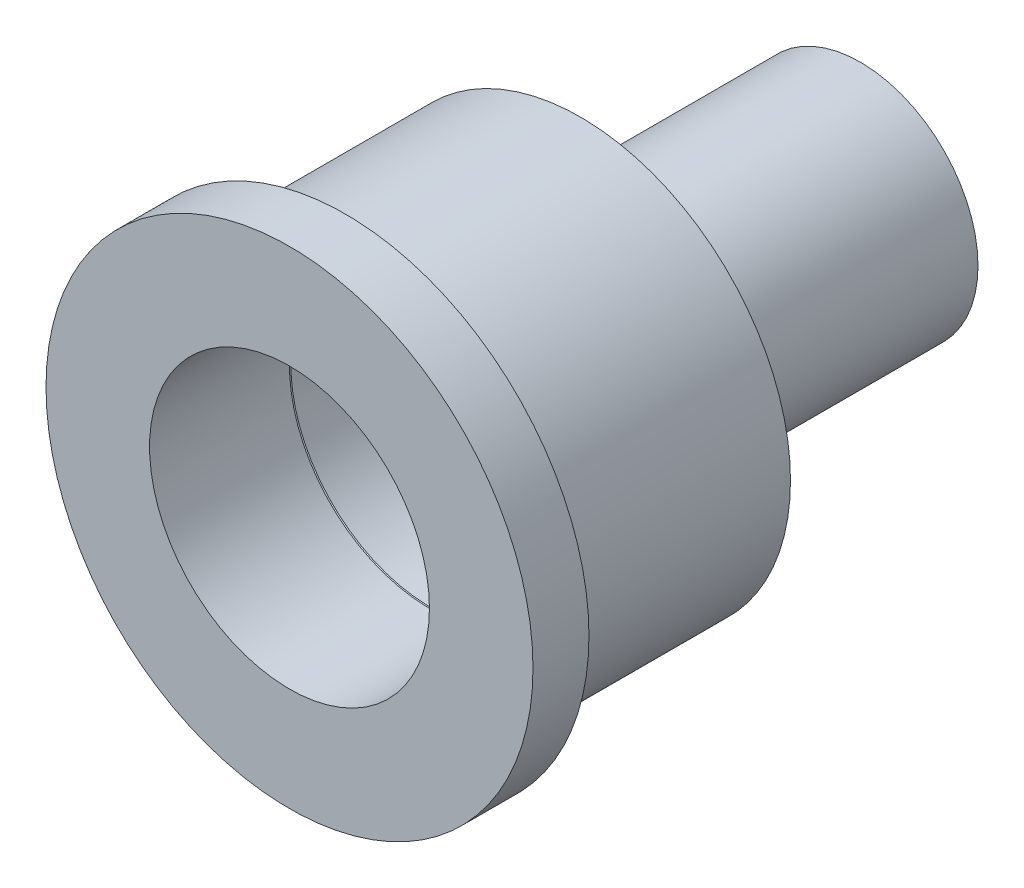
from build123d import *

# Parameters (mm, degrees)
SKETCH_1_R          = 2.1
EXTRUDE_1_DEPTH     = 5
SKETCH_2_R          = 3.75
EXTRUDE_2_DEPTH     = 4.2
SKETCH_3_R          = 4.35
EXTRUDE_3_DEPTH     = 1
SKETCH_9_R          = 2.5
CUT_EXTRUDE_1_DEPTH = 2.5


with BuildPart() as part:
    # 스케치1 → 보스-돌출1 (new body)
    with BuildSketch(Plane.XY):
        Circle(SKETCH_1_R)
    extrude(amount=EXTRUDE_1_DEPTH)

    # 스케치2 → 보스-돌출2 (add)
    with BuildSketch(Plane.XY.offset(5)):
        Circle(SKETCH_2_R)
    extrude(amount=EXTRUDE_2_DEPTH)

    # 스케치3 → 보스-돌출3 (add)
    with BuildSketch(Plane.XY.offset(9.2)):
        Circle(SKETCH_3_R)
    extrude(amount=EXTRUDE_3_DEPTH)

    # 스케치9 → 컷-돌출1 (cut)
    with BuildSketch(Plane.XY.offset(10.2)):
        Circle(SKETCH_9_R)
    extrude(amount=-CUT_EXTRUDE_1_DEPTH, mode=Mode.SUBTRACT)

    # 스케치13 → M2 남비 머리 나사용 카운터보어2 (revolve, cut)
    with BuildSketch(Plane(origin=(0, 0, 7.7), x_dir=(0, -1, 0), z_dir=(1, 0, 0))):
        Polygon((0, 0), (0, 8.781118805), (1.3, 8), (1.3, 1.6), (2.5, 1.6), (2.5, 0.025), (2.525, 0), align=None)
    revolve(axis=Axis((0, 0, 14.05), (0, 0, -1)), mode=Mode.SUBTRACT)


solid = part.part
